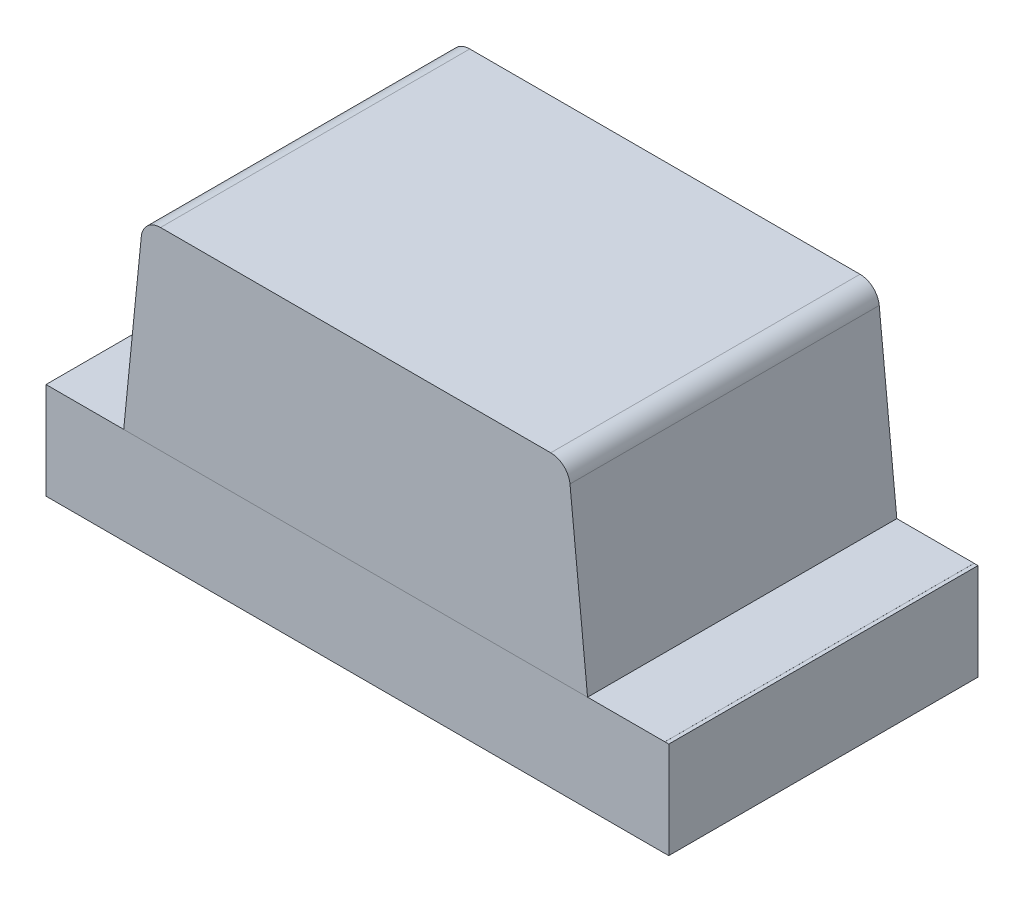
from build123d import *

# Parameters (mm, degrees)
SKETCH1_W             = 1.6
SKETCH1_H             = 0.25
EXTRUDE1_DEPTH        = 0.4
EXTRUDE2_DEPTH        = 0.4
EXTRUDE3_DEPTH        = 0.0001
EXTRUDE3_DEPTH_BACK   = 0.01
EXTRUDE4_DEPTH        = 0.0001
EXTRUDE4_DEPTH_BACK   = 0.01
SKETCH2_3_W           = 0.3
SKETCH2_3_H           = 0.8
EXTRUDE4_2_DEPTH      = 0.0001
EXTRUDE4_2_DEPTH_BACK = 0.01
EXTRUDE5_DEPTH        = 0.0001
EXTRUDE5_DEPTH_BACK   = 0.01
SKETCH3_W             = 0.2
SKETCH3_H             = 0.8
EXTRUDE5_2_DEPTH      = 0.0001
EXTRUDE5_2_DEPTH_BACK = 0.01
FILLET1_R             = 0.05
EXTRUDE6_DEPTH        = 0.01
EXTRUDE6_DEPTH_BACK   = 0.0001
SKETCH5_W             = 0.8
SKETCH5_H             = 0.25
EXTRUDE7_DEPTH        = 0.001
EXTRUDE7_DEPTH_BACK   = 0.01
SKETCH6_W             = 0.8
SKETCH6_H             = 0.2502
SKETCH7_W             = 0.013291139
SKETCH7_H             = 0.012658227
SKETCH7_H_2           = 0.012658228
CUT_EXTRUDE1_DEPTH    = 0.01


with BuildPart() as part:
    # Sketch1 → Extrude1 (new, symmetric)
    with BuildSketch(Plane.XY):
        Rectangle(SKETCH1_W, SKETCH1_H)
    extrude(amount=EXTRUDE1_DEPTH, both=True)



with BuildPart() as body_2:
    # Sketch1<3> → Extrude2 (new, symmetric)
    with BuildSketch(Plane.XY):
        Polygon((-0.55, 0.625), (-0.6, 0.125), (0.6, 0.125), (0.55, 0.625), align=None)
    extrude(amount=EXTRUDE2_DEPTH, both=True)

    # Fillet1
    fillet1_edges = [body_2.edges().sort_by_distance(p)[0] for p in [
        (-0.55, 0.625, 0),
        (0.55, 0.625, 0),
    ]]
    fillet(fillet1_edges, radius=FILLET1_R)


with BuildPart() as body_3:
    # Sketch2 → Extrude3 (new, two sides: drawn at the far end of the back side and taken through both)
    with BuildSketch(Plane.XZ.offset(0.125).offset(-EXTRUDE3_DEPTH_BACK)):
        Polygon((-0.339833711, 0.4), (-0.339833711, -0.4), (0.32532124, 0), align=None)
    extrude(amount=EXTRUDE3_DEPTH + EXTRUDE3_DEPTH_BACK)


with BuildPart() as body_4:
    # Sketch2<3> → Extrude4 (new, two sides: drawn at the far end of the back side and taken through both)
    with BuildSketch(Plane.XZ.offset(0.125).offset(-EXTRUDE4_DEPTH_BACK)):
        with Locations((-0.65, 0)):
            Rectangle(SKETCH2_3_W, SKETCH2_3_H)
    extrude(amount=EXTRUDE4_DEPTH + EXTRUDE4_DEPTH_BACK)


with BuildPart() as body_5:
    # Sketch2<3> → Extrude4 2 (new, two sides: drawn at the far end of the back side and taken through both)
    with BuildSketch(Plane.XZ.offset(0.125).offset(-EXTRUDE4_2_DEPTH_BACK)):
        with Locations((0.65, 0)):
            Rectangle(SKETCH2_3_W, SKETCH2_3_H)
    extrude(amount=EXTRUDE4_2_DEPTH + EXTRUDE4_2_DEPTH_BACK)


with BuildPart() as body_6:
    # Sketch3 → Extrude5 (new, two sides: drawn at the far end of the back side and taken through both)
    with BuildSketch(Plane(origin=(0, 0.125, 0), x_dir=(-1, 0, 0), z_dir=(0, 1, 0)).offset(-EXTRUDE5_DEPTH_BACK)):
        with Locations((0.7, 0)):
            Rectangle(SKETCH3_W, SKETCH3_H)
    extrude(amount=EXTRUDE5_DEPTH + EXTRUDE5_DEPTH_BACK)


with BuildPart() as body_7:
    # Sketch3 → Extrude5 2 (new, two sides: drawn at the far end of the back side and taken through both)
    with BuildSketch(Plane(origin=(0, 0.125, 0), x_dir=(-1, 0, 0), z_dir=(0, 1, 0)).offset(-EXTRUDE5_2_DEPTH_BACK)):
        with Locations((-0.7, 0)):
            Rectangle(SKETCH3_W, SKETCH3_H)
    extrude(amount=EXTRUDE5_2_DEPTH + EXTRUDE5_2_DEPTH_BACK)


with BuildPart() as part_1:
    add(part.part)

    add(body_5.part)  # Extrude6 merges body 5

    add(body_7.part)  # Extrude6 merges body 7
    # Sketch5 → Extrude6 (add, two sides: drawn at the far end of the back side and taken through both)
    with BuildSketch(Plane(origin=(0.8, 0, 0), x_dir=(0, 0, -1), z_dir=(1, 0, 0)).offset(-EXTRUDE6_DEPTH_BACK)):
        Rectangle(SKETCH5_W, SKETCH5_H)
    extrude(amount=EXTRUDE6_DEPTH + EXTRUDE6_DEPTH_BACK)


    add(body_4.part)  # Extrude7 merges body 4

    add(body_6.part)  # Extrude7 merges body 6
    # Sketch6 → Extrude7 (add, two sides: drawn at the far end of the back side and taken through both)
    with BuildSketch(Plane.ZY.offset(0.8).offset(-EXTRUDE7_DEPTH_BACK)):
        Rectangle(SKETCH6_W, SKETCH6_H)
    extrude(amount=EXTRUDE7_DEPTH + EXTRUDE7_DEPTH_BACK)

    # Sketch7 → Cut-Extrude1 (cut)
    # profile 1 of 14: a face of its own
    with BuildSketch(Plane.XZ.offset(0.1251)):
        Polygon((-0.707001992, 0.286075949), (-0.744343764, 0.297804589), (-0.744343764, 0.310176028), (-0.719175647, 0.318384098), (-0.744343764, 0.326147152), (-0.744343764, 0.339013054), (-0.707001992, 0.350632911), (-0.707001992, 0.338043908), (-0.732743685, 0.331546677), (-0.707001992, 0.323338608), (-0.707001992, 0.312589003), (-0.732743685, 0.30443038), (-0.707001992, 0.298022152), align=None)
    # profile 2 of 14: a face of its own
    with BuildSketch(Plane.XZ.offset(0.1251)):
        Polygon((-0.707001992, 0.218987342), (-0.744343764, 0.230715981), (-0.744343764, 0.243087421), (-0.719175647, 0.251295491), (-0.744343764, 0.259058544), (-0.744343764, 0.271924446), (-0.707001992, 0.283544304), (-0.707001992, 0.270955301), (-0.732743685, 0.26445807), (-0.707001992, 0.25625), (-0.707001992, 0.245500396), (-0.732743685, 0.237341772), (-0.707001992, 0.230933544), align=None)
    # profile 3 of 14: a face of its own
    with BuildSketch(Plane.XZ.offset(0.1251)):
        Polygon((-0.707001992, 0.151898734), (-0.744343764, 0.163627373), (-0.744343764, 0.175998813), (-0.719175647, 0.184206883), (-0.744343764, 0.191969937), (-0.744343764, 0.204835839), (-0.707001992, 0.216455696), (-0.707001992, 0.203866693), (-0.732743685, 0.197369462), (-0.707001992, 0.189161392), (-0.707001992, 0.178411788), (-0.732743685, 0.170253165), (-0.707001992, 0.163844937), align=None)
    # profile 4 of 14: a face of its own
    with BuildSketch(Plane.XZ.offset(0.1251)):
        with Locations((-0.737698195, 0.137974684)):
            Rectangle(SKETCH7_W, SKETCH7_H)
    # profile 5 of 14: a face of its own
    with BuildSketch(Plane.XZ.offset(0.1251)):
        with BuildLine():
            add(Edge.make_bspline(
                [(-0.728758321, 0.079746835), (-0.729369388, 0.079765085), (-0.73056932, 0.07980092), (-0.732323163, 0.080105713), (-0.733985315, 0.080602697), (-0.735567388, 0.081288866), (-0.737052132, 0.082185594), (-0.738453578, 0.08327723), (-0.73975585, 0.084571671), (-0.740974038, 0.086045073), (-0.742065093, 0.087693545), (-0.74301811, 0.089492402), (-0.743815446, 0.091432415), (-0.744484978, 0.093506521), (-0.744979195, 0.095729794), (-0.745341189, 0.098088543), (-0.745577848, 0.100585257), (-0.745598831, 0.102297046), (-0.745609587, 0.103174446)],
                knots=[0, 0, 0, 0, 0.907312236, 1.78165839, 2.635367075, 3.479697475, 4.336364812, 5.205276731, 6.11257575, 7.058770404, 8.040786331, 9.044147278, 10.078219212, 11.153049307, 12.278104542, 13.457648573, 14.696882856, 16, 16, 16, 16], degree=3))
            add(Edge.make_bspline(
                [(-0.745609587, 0.103174446), (-0.745597551, 0.104183574), (-0.745574239, 0.106138165), (-0.745359939, 0.108969928), (-0.74503687, 0.111603946), (-0.744553599, 0.114051804), (-0.743953216, 0.116354103), (-0.74330757, 0.118570737), (-0.742575363, 0.120711393), (-0.742025284, 0.122097938), (-0.741752783, 0.12278481)],
                knots=[0, 0, 0, 0, 1.203215828, 2.33052265, 3.384689099, 4.366106119, 5.303329643, 6.221311756, 7.118865988, 8, 8, 8, 8], degree=3))
            Line((-0.741752783, 0.12278481), (-0.729786802, 0.12278481))
            Line((-0.729786802, 0.12278481), (-0.729786802, 0.121360759))
            add(Edge.make_bspline(
                [(-0.729786802, 0.121360759), (-0.73032753, 0.120678102), (-0.73140581, 0.119316796), (-0.732787113, 0.11710018), (-0.733988194, 0.114776357), (-0.734975195, 0.112353621), (-0.735768357, 0.109905199), (-0.736315121, 0.10746751), (-0.736688795, 0.105084716), (-0.736729049, 0.103505432), (-0.736748828, 0.10272943)],
                knots=[0, 0, 0, 0, 1.030622468, 2.055194264, 3.087043286, 4.125157485, 5.149848264, 6.130935704, 7.081611712, 8, 8, 8, 8], degree=3))
            add(Edge.make_bspline(
                [(-0.736748828, 0.10272943), (-0.73674838, 0.102515041), (-0.736747423, 0.10205605), (-0.736683001, 0.101322032), (-0.73663642, 0.100492732), (-0.736531811, 0.099603299), (-0.736422519, 0.09870789), (-0.736232359, 0.09788056), (-0.73605144, 0.097128741), (-0.735867351, 0.0966755), (-0.735779682, 0.096459652)],
                knots=[0, 0, 0, 0, 0.806378557, 1.726393851, 2.771014456, 3.931269413, 5.096090628, 6.161710732, 7.124547685, 8, 8, 8, 8], degree=3))
            add(Edge.make_bspline(
                [(-0.735779682, 0.096459652), (-0.73566577, 0.096219758), (-0.735441909, 0.095748317), (-0.735033106, 0.095100857), (-0.734597455, 0.094509521), (-0.734114745, 0.093978791), (-0.733525791, 0.093553657), (-0.732825363, 0.093239557), (-0.732000213, 0.09306801), (-0.731412708, 0.093048363), (-0.731102071, 0.093037975)],
                knots=[0, 0, 0, 0, 1.024407818, 2.013179384, 2.949802342, 3.859052226, 4.77034807, 5.732977883, 6.801339628, 8, 8, 8, 8], degree=3))
            add(Edge.make_bspline(
                [(-0.731102071, 0.093037975), (-0.730829123, 0.093053696), (-0.730292427, 0.093084607), (-0.729528429, 0.093375503), (-0.72881749, 0.093816952), (-0.728187133, 0.094460463), (-0.727608414, 0.095257502), (-0.727123265, 0.09623537), (-0.726683228, 0.09736186), (-0.726474594, 0.098184089), (-0.726365125, 0.098615506)],
                knots=[0, 0, 0, 0, 0.825212765, 1.622611382, 2.449701629, 3.348069183, 4.336544339, 5.428209675, 6.6506027, 8, 8, 8, 8], degree=3))
            add(Edge.make_bspline(
                [(-0.726365125, 0.098615506), (-0.726141255, 0.09959987), (-0.72568266, 0.101616324), (-0.725109106, 0.104690378), (-0.72447607, 0.107755492), (-0.723871299, 0.109734848), (-0.723576359, 0.110700158)],
                knots=[0, 0, 0, 0, 0.976104583, 1.999535498, 3.024395274, 4, 4, 4, 4], degree=3))
            add(Edge.make_bspline(
                [(-0.723576359, 0.110700158), (-0.723399863, 0.111219416), (-0.723056296, 0.1122302), (-0.722475484, 0.113675972), (-0.721840508, 0.115006529), (-0.721162942, 0.116226584), (-0.720425943, 0.117326245), (-0.719659249, 0.11832384), (-0.71883233, 0.119195603), (-0.71796637, 0.119969445), (-0.717040369, 0.120631102), (-0.7160683, 0.121208477), (-0.715038068, 0.121696295), (-0.713957424, 0.122100736), (-0.712817989, 0.122409273), (-0.711629552, 0.122619901), (-0.710387872, 0.122769095), (-0.709540696, 0.122779501), (-0.7091084, 0.12278481)],
                knots=[0, 0, 0, 0, 1.287286806, 2.505824366, 3.654938963, 4.74627059, 5.778586806, 6.75996495, 7.696030012, 8.595059759, 9.482019644, 10.363222407, 11.245851011, 12.154256429, 13.068444161, 14.012503255, 14.985824751, 16, 16, 16, 16], degree=3))
            add(Edge.make_bspline(
                [(-0.7091084, 0.12278481), (-0.708530328, 0.122766159), (-0.707392692, 0.122729454), (-0.70572817, 0.12242874), (-0.704153801, 0.121915445), (-0.70265207, 0.121222413), (-0.701245527, 0.120308099), (-0.699906253, 0.119215702), (-0.698670457, 0.117903678), (-0.697520291, 0.116415118), (-0.696480591, 0.114771425), (-0.695565313, 0.113001934), (-0.694796987, 0.111117289), (-0.69416004, 0.109124516), (-0.693682705, 0.107015281), (-0.693323239, 0.104796665), (-0.693116648, 0.102459771), (-0.693091023, 0.10086406), (-0.693077942, 0.100049446)],
                knots=[0, 0, 0, 0, 0.894990994, 1.761326291, 2.609044902, 3.454222546, 4.315366365, 5.200560057, 6.125081389, 7.100429509, 8.110379559, 9.133447974, 10.182136699, 11.259192205, 12.370181258, 13.528580438, 14.738335141, 16, 16, 16, 16], degree=3))
            add(Edge.make_bspline(
                [(-0.693077942, 0.100049446), (-0.693089037, 0.099215103), (-0.69311121, 0.09754783), (-0.693300199, 0.095057109), (-0.693577813, 0.092576858), (-0.693998666, 0.090144943), (-0.694486874, 0.087799665), (-0.695034772, 0.085593047), (-0.695653754, 0.083553317), (-0.696130927, 0.082266485), (-0.696361169, 0.08164557)],
                knots=[0, 0, 0, 0, 1.065403572, 2.129000689, 3.188532477, 4.251604565, 5.279552602, 6.247508681, 7.154397237, 8, 8, 8, 8], degree=3))
            Line((-0.696361169, 0.08164557), (-0.707634904, 0.08164557))
            Line((-0.707634904, 0.08164557), (-0.707634904, 0.083059731))
            add(Edge.make_bspline(
                [(-0.707634904, 0.083059731), (-0.70723473, 0.083596183), (-0.706416365, 0.084693243), (-0.705374529, 0.086523061), (-0.704395596, 0.088502179), (-0.703553517, 0.090641594), (-0.702823776, 0.092871108), (-0.702314193, 0.095162587), (-0.701993288, 0.097475669), (-0.701956901, 0.099026524), (-0.701938701, 0.099802215)],
                knots=[0, 0, 0, 0, 0.892283326, 1.824742884, 2.804416662, 3.836872171, 4.8899239, 5.931447339, 6.965372909, 8, 8, 8, 8], degree=3))
            add(Edge.make_bspline(
                [(-0.701938701, 0.099802215), (-0.701949427, 0.100350049), (-0.701970878, 0.101445657), (-0.70216622, 0.103079762), (-0.702481667, 0.104700792), (-0.702891308, 0.105721053), (-0.703095742, 0.106230222)],
                knots=[0, 0, 0, 0, 0.999146175, 1.998183711, 3.000980573, 4, 4, 4, 4], degree=3))
            add(Edge.make_bspline(
                [(-0.703095742, 0.106230222), (-0.703196476, 0.106446973), (-0.703397875, 0.106880332), (-0.703784157, 0.107483654), (-0.704248563, 0.108035989), (-0.704774559, 0.108532027), (-0.705352745, 0.108966226), (-0.705990159, 0.109273902), (-0.706671616, 0.109461838), (-0.707139231, 0.109482917), (-0.707377783, 0.109493671)],
                knots=[0, 0, 0, 0, 1.00524851, 2.009826503, 3.004679593, 4.035271301, 5.048246368, 6.034938417, 6.997532266, 8, 8, 8, 8], degree=3))
            add(Edge.make_bspline(
                [(-0.707377783, 0.109493671), (-0.707696866, 0.109476452), (-0.708306604, 0.109443548), (-0.709164502, 0.109140256), (-0.709903719, 0.108647839), (-0.710401179, 0.108067536), (-0.710749898, 0.107508972), (-0.711005153, 0.106991142), (-0.711246832, 0.106386528), (-0.711495567, 0.105700905), (-0.71174116, 0.104932741), (-0.711978934, 0.104078462), (-0.712203582, 0.103137104), (-0.712346677, 0.102479167), (-0.712421296, 0.102136076)],
                knots=[0, 0, 0, 0, 1.173816843, 2.243057204, 3.312297565, 4.415174738, 5.03266065, 5.73970059, 6.541434878, 7.433956553, 8.430083051, 9.515931566, 10.70464786, 12, 12, 12, 12], degree=3))
            add(Edge.make_bspline(
                [(-0.712421296, 0.102136076), (-0.712609327, 0.101219681), (-0.712978766, 0.099419168), (-0.71353051, 0.096718577), (-0.714167994, 0.09396719), (-0.714742396, 0.092134526), (-0.715041945, 0.091178797)],
                knots=[0, 0, 0, 0, 0.995744513, 1.956417928, 2.934277412, 4, 4, 4, 4], degree=3))
            add(Edge.make_bspline(
                [(-0.715041945, 0.091178797), (-0.715201567, 0.09070552), (-0.715513813, 0.089779714), (-0.716056954, 0.088459399), (-0.716643946, 0.087235869), (-0.717264711, 0.086102353), (-0.717936694, 0.085065368), (-0.718648018, 0.084118027), (-0.719411472, 0.083276117), (-0.720218086, 0.082527335), (-0.721073136, 0.081867755), (-0.721992673, 0.081301606), (-0.722967074, 0.080815492), (-0.724010174, 0.080430689), (-0.725107467, 0.080121679), (-0.726273151, 0.079910131), (-0.72749534, 0.079763139), (-0.728332628, 0.079752331), (-0.728758321, 0.079746835)],
                knots=[0, 0, 0, 0, 1.237467875, 2.420686895, 3.535046182, 4.599015201, 5.620884487, 6.594603852, 7.531477383, 8.433220087, 9.318759595, 10.202828513, 11.105163009, 12.01247538, 12.953896178, 13.926381251, 14.945733412, 16, 16, 16, 16], degree=3))
        make_face()
    # profile 6 of 14: a face of its own
    with BuildSketch(Plane.XZ.offset(0.1251)):
        with BuildLine():
            Line((-0.744343764, 0.033544304), (-0.744343764, 0.04556962))
            Line((-0.744343764, 0.04556962), (-0.740427625, 0.04556962))
            add(Edge.make_bspline(
                [(-0.740427625, 0.04556962), (-0.740831904, 0.046116275), (-0.741611349, 0.047170216), (-0.742651457, 0.048756729), (-0.74353909, 0.050269774), (-0.744318701, 0.051726519), (-0.744906393, 0.053237621), (-0.745320427, 0.054853378), (-0.745570313, 0.05660479), (-0.745596205, 0.057818238), (-0.745609587, 0.058445411)],
                knots=[0, 0, 0, 0, 1.150872466, 2.218865267, 3.209461834, 4.120482262, 5.012764827, 5.946708227, 6.938749913, 8, 8, 8, 8], degree=3))
            add(Edge.make_bspline(
                [(-0.745609587, 0.058445411), (-0.745598228, 0.058953587), (-0.745576107, 0.059943153), (-0.745403669, 0.061381773), (-0.745134843, 0.062735587), (-0.744731047, 0.063993106), (-0.744248146, 0.065175101), (-0.743608167, 0.066243876), (-0.74289308, 0.067245677), (-0.742039557, 0.068136513), (-0.74109069, 0.068944324), (-0.74002446, 0.069635599), (-0.738857998, 0.070224454), (-0.737582071, 0.070695003), (-0.736202919, 0.071072548), (-0.734713295, 0.071334514), (-0.733119731, 0.07149481), (-0.732022166, 0.07151078), (-0.731458084, 0.071518987)],
                knots=[0, 0, 0, 0, 1.109008058, 2.159558935, 3.158726032, 4.116861086, 5.039058877, 5.938775559, 6.82970133, 7.720510853, 8.624361809, 9.544451588, 10.487360536, 11.471068125, 12.508000841, 13.604731202, 14.768976642, 16, 16, 16, 16], degree=3))
            Line((-0.731458084, 0.071518987), (-0.707001992, 0.071518987))
            Line((-0.707001992, 0.071518987), (-0.707001992, 0.059493671))
            Line((-0.707001992, 0.059493671), (-0.725791549, 0.059493671))
            add(Edge.make_bspline(
                [(-0.725791549, 0.059493671), (-0.726249785, 0.059492853), (-0.727126892, 0.059491288), (-0.728379796, 0.059450118), (-0.729513882, 0.059389668), (-0.730534896, 0.059320316), (-0.731458272, 0.059193807), (-0.732291352, 0.059004953), (-0.733051153, 0.05876954), (-0.733504504, 0.058537381), (-0.73372272, 0.058425633)],
                knots=[0, 0, 0, 0, 1.361401701, 2.605856924, 3.723918663, 4.735739235, 5.645738665, 6.489217889, 7.27279937, 8, 8, 8, 8], degree=3))
            add(Edge.make_bspline(
                [(-0.73372272, 0.058425633), (-0.733922077, 0.05831063), (-0.734313997, 0.058084543), (-0.734817086, 0.057624398), (-0.73523922, 0.057085026), (-0.735567234, 0.056446225), (-0.735816709, 0.055702951), (-0.735986827, 0.054838985), (-0.736094578, 0.053846304), (-0.736108532, 0.053141795), (-0.736115916, 0.052768987)],
                knots=[0, 0, 0, 0, 0.849138082, 1.669332372, 2.503455908, 3.370611167, 4.311442699, 5.394692208, 6.621337967, 8, 8, 8, 8], degree=3))
            add(Edge.make_bspline(
                [(-0.736115916, 0.052768987), (-0.736107238, 0.052498345), (-0.736089394, 0.051941887), (-0.735973171, 0.05108623), (-0.735794834, 0.050187942), (-0.735464906, 0.04893065), (-0.734871816, 0.047347337), (-0.734194613, 0.046167686), (-0.73385128, 0.04556962)],
                knots=[0, 0, 0, 0, 0.638127216, 1.312033637, 2.033062677, 2.79661882, 4.375931797, 6, 6, 6, 6], degree=3))
            Line((-0.73385128, 0.04556962), (-0.707001992, 0.04556962))
            Line((-0.707001992, 0.04556962), (-0.707001992, 0.033544304))
            Line((-0.707001992, 0.033544304), (-0.744343764, 0.033544304))
        make_face()
    # profile 7 of 14: a face of its own
    with BuildSketch(Plane.XZ.offset(0.1251)):
        with BuildLine():
            Line((-0.744343764, -0.015189873), (-0.744343764, -0.003164557))
            Line((-0.744343764, -0.003164557), (-0.725554207, -0.003164557))
            add(Edge.make_bspline(
                [(-0.725554207, -0.003164557), (-0.724789186, -0.0031523), (-0.723263673, -0.003127858), (-0.721382468, -0.002986796), (-0.719961306, -0.002797535), (-0.719042365, -0.002612707), (-0.718268296, -0.002396857), (-0.717825416, -0.002190717), (-0.717623036, -0.002096519)],
                knots=[0, 0, 0, 0, 1.709124929, 3.408128882, 4.211124727, 4.91016634, 5.501986363, 6, 6, 6, 6], degree=3))
            add(Edge.make_bspline(
                [(-0.717623036, -0.002096519), (-0.71742401, -0.001974288), (-0.71703379, -0.001734636), (-0.716527283, -0.001265974), (-0.716112863, -0.000719031), (-0.715772088, -8.3646e-05), (-0.715536797, 0.000661952), (-0.715340182, 0.001520323), (-0.715256728, 0.002513632), (-0.715239148, 0.003217267), (-0.71522984, 0.003589794)],
                knots=[0, 0, 0, 0, 0.86006424, 1.686277094, 2.52783008, 3.38194165, 4.331801563, 5.402842185, 6.624978739, 8, 8, 8, 8], degree=3))
            add(Edge.make_bspline(
                [(-0.71522984, 0.003589794), (-0.715258209, 0.004155705), (-0.715316136, 0.005311252), (-0.715671889, 0.006742349), (-0.716081369, 0.007907651), (-0.716460784, 0.008833913), (-0.716946505, 0.009788229), (-0.717307416, 0.010427935), (-0.717494476, 0.010759494)],
                knots=[0, 0, 0, 0, 1.338371478, 2.732853438, 3.468019217, 4.261884641, 5.099136535, 6, 6, 6, 6], degree=3))
            Line((-0.717494476, 0.010759494), (-0.744343764, 0.010759494))
            Line((-0.744343764, 0.010759494), (-0.744343764, 0.02278481))
            Line((-0.744343764, 0.02278481), (-0.707001992, 0.02278481))
            Line((-0.707001992, 0.02278481), (-0.707001992, 0.010759494))
            Line((-0.707001992, 0.010759494), (-0.710918131, 0.010759494))
            add(Edge.make_bspline(
                [(-0.710918131, 0.010759494), (-0.710515056, 0.01023079), (-0.709730445, 0.009201638), (-0.708710234, 0.007612019), (-0.70781085, 0.00607007), (-0.707054441, 0.004543565), (-0.706451054, 0.002986088), (-0.706045559, 0.001354709), (-0.705773658, -0.000353494), (-0.705748811, -0.001521852), (-0.705736169, -0.002116297)],
                knots=[0, 0, 0, 0, 1.126119141, 2.192057864, 3.198061997, 4.149848529, 5.076251285, 6.021887753, 6.99356175, 8, 8, 8, 8], degree=3))
            add(Edge.make_bspline(
                [(-0.705736169, -0.002116297), (-0.705748864, -0.002614433), (-0.705773646, -0.003586883), (-0.705928501, -0.005004263), (-0.706203833, -0.006339973), (-0.706602748, -0.00758611), (-0.707095554, -0.00875742), (-0.707711311, -0.009838393), (-0.708440523, -0.010834428), (-0.709271024, -0.011748628), (-0.710215887, -0.012564037), (-0.711274519, -0.013272555), (-0.712446068, -0.013862546), (-0.713726222, -0.014347902), (-0.715108777, -0.014735114), (-0.716606759, -0.014992679), (-0.718208849, -0.015169571), (-0.71931687, -0.015182971), (-0.719887673, -0.015189873)],
                knots=[0, 0, 0, 0, 1.08848837, 2.124922927, 3.110950502, 4.063144162, 4.979605775, 5.882838355, 6.774625441, 7.671951181, 8.57587277, 9.494821853, 10.448322275, 11.435533005, 12.482327682, 13.580118324, 14.753386918, 16, 16, 16, 16], degree=3))
            Line((-0.719887673, -0.015189873), (-0.744343764, -0.015189873))
        make_face()
    # profile 8 of 14: a face of its own
    with BuildSketch(Plane.XZ.offset(0.1251)):
        Polygon((-0.744343764, -0.062658228), (-0.744343764, -0.026582278), (-0.694343764, -0.026582278), (-0.694343764, -0.039240506), (-0.734850093, -0.039240506), (-0.734850093, -0.062658228), align=None)
    # profile 9 of 14: a face of its own
    with BuildSketch(Plane.XZ.offset(0.1251)):
        Polygon((-0.744343764, -0.106329114), (-0.744343764, -0.070253165), (-0.694343764, -0.070253165), (-0.694343764, -0.106329114), (-0.703837435, -0.106329114), (-0.703837435, -0.082911392), (-0.712698195, -0.082911392), (-0.712698195, -0.10443038), (-0.722191866, -0.10443038), (-0.722191866, -0.082911392), (-0.734850093, -0.082911392), (-0.734850093, -0.106329114), align=None)
    # profile 10 of 14: a face of its own
    with BuildSketch(Plane.XZ.offset(0.1251)):
        with BuildLine():
            add(Edge.make_bspline(
                [(-0.719393211, -0.164556962), (-0.719967055, -0.164547304), (-0.721103498, -0.164528178), (-0.722785901, -0.164380583), (-0.724418739, -0.16411757), (-0.726010863, -0.163777979), (-0.727550327, -0.163316726), (-0.729054116, -0.16277587), (-0.730506863, -0.162121047), (-0.73190758, -0.16136862), (-0.733243631, -0.160543884), (-0.734503736, -0.15965651), (-0.735695344, -0.15873362), (-0.736792791, -0.157738964), (-0.737813801, -0.156699373), (-0.738759208, -0.155611609), (-0.739610924, -0.154459076), (-0.740122366, -0.153655495), (-0.740378179, -0.15325356)],
                knots=[0, 0, 0, 0, 1.105570398, 2.18947457, 3.250358341, 4.290584537, 5.323553275, 6.344225964, 7.367641686, 8.3905646, 9.405808457, 10.390761353, 11.358902336, 12.307789878, 13.241960776, 14.165076779, 15.082208636, 16, 16, 16, 16], degree=3))
            add(Edge.make_bspline(
                [(-0.740378179, -0.15325356), (-0.740734249, -0.152633946), (-0.741448205, -0.151391556), (-0.7422825, -0.149399639), (-0.742984558, -0.147336898), (-0.74351177, -0.145161705), (-0.743875292, -0.1428382), (-0.744155696, -0.140337495), (-0.744306575, -0.1376337), (-0.744331085, -0.135766253), (-0.744343764, -0.134800237)],
                knots=[0, 0, 0, 0, 0.896288622, 1.797150563, 2.705281913, 3.629615989, 4.602417572, 5.655716007, 6.787320449, 8, 8, 8, 8], degree=3))
            Line((-0.744343764, -0.134800237), (-0.744343764, -0.117088608))
            Line((-0.744343764, -0.117088608), (-0.694343764, -0.117088608))
            Line((-0.694343764, -0.117088608), (-0.694343764, -0.135304589))
            add(Edge.make_bspline(
                [(-0.694343764, -0.135304589), (-0.69435207, -0.136293955), (-0.69436809, -0.138202319), (-0.694576885, -0.140960738), (-0.694875297, -0.143513342), (-0.695337733, -0.145856016), (-0.695895405, -0.148006019), (-0.69657497, -0.149968756), (-0.697324323, -0.151774643), (-0.69796117, -0.152864064), (-0.698269793, -0.153392009)],
                knots=[0, 0, 0, 0, 1.267175336, 2.444223962, 3.542125549, 4.557526608, 5.500936977, 6.385043188, 7.217374394, 8, 8, 8, 8], degree=3))
            add(Edge.make_bspline(
                [(-0.698269793, -0.153392009), (-0.698538063, -0.153817486), (-0.69907152, -0.154663548), (-0.699962446, -0.155864156), (-0.700940485, -0.156978869), (-0.701966394, -0.158043121), (-0.703067837, -0.15903303), (-0.704237191, -0.159954629), (-0.705476238, -0.160806538), (-0.706780972, -0.16158552), (-0.708145998, -0.162295927), (-0.709582528, -0.16289058), (-0.711071793, -0.163415255), (-0.712626274, -0.163818023), (-0.714230192, -0.16416698), (-0.715900864, -0.164384347), (-0.717627108, -0.164527653), (-0.718799553, -0.16454711), (-0.719393211, -0.164556962)],
                knots=[0, 0, 0, 0, 0.964065863, 1.917049184, 2.86229036, 3.805247319, 4.749389377, 5.698846072, 6.657678277, 7.629829384, 8.610569287, 9.604676042, 10.607940105, 11.6349849, 12.681042988, 13.752616828, 14.862056989, 16, 16, 16, 16], degree=3))
        make_face()
        with BuildLine():
            add(Edge.make_bspline(
                [(-0.719314097, -0.151265823), (-0.718911717, -0.151260702), (-0.718122425, -0.151250659), (-0.716964667, -0.151154875), (-0.715849842, -0.151025347), (-0.714782496, -0.15080982), (-0.713752711, -0.150559996), (-0.712773964, -0.150238922), (-0.711834177, -0.149876723), (-0.710945433, -0.149435904), (-0.710091242, -0.148949086), (-0.709298484, -0.148375339), (-0.708542041, -0.14775117), (-0.707828049, -0.147062027), (-0.707175101, -0.146290557), (-0.706560063, -0.145460506), (-0.7059959, -0.144560327), (-0.705665875, -0.143923833), (-0.705498828, -0.143601661)],
                knots=[0, 0, 0, 0, 1.152093354, 2.259898929, 3.325467225, 4.364140538, 5.376172865, 6.358396836, 7.312077728, 8.257828931, 9.196960457, 10.124297759, 11.056236784, 12.004246951, 12.961658638, 13.947279359, 14.960983522, 16, 16, 16, 16], degree=3))
            add(Edge.make_bspline(
                [(-0.705498828, -0.143601661), (-0.705345472, -0.143264213), (-0.705041509, -0.142595365), (-0.704675913, -0.141559954), (-0.704389495, -0.140515262), (-0.704174066, -0.139414463), (-0.704013101, -0.138179583), (-0.703914472, -0.136716792), (-0.703843387, -0.134988837), (-0.703839511, -0.13374548), (-0.703837435, -0.133079509)],
                knots=[0, 0, 0, 0, 0.826967603, 1.639107464, 2.447640171, 3.242670507, 4.14065217, 5.225198036, 6.513753944, 8, 8, 8, 8], degree=3))
            Line((-0.703837435, -0.133079509), (-0.703837435, -0.129746835))
            Line((-0.703837435, -0.129746835), (-0.734850093, -0.129746835))
            Line((-0.734850093, -0.129746835), (-0.734850093, -0.133079509))
            add(Edge.make_bspline(
                [(-0.734850093, -0.133079509), (-0.734847719, -0.133458613), (-0.734843134, -0.134190496), (-0.734821603, -0.135248617), (-0.734798159, -0.136231516), (-0.734739928, -0.137133951), (-0.734703605, -0.137963293), (-0.734614415, -0.138706684), (-0.734543325, -0.139377929), (-0.734409464, -0.140161727), (-0.734201372, -0.14108831), (-0.733862283, -0.14216894), (-0.733437085, -0.143239207), (-0.733094602, -0.143933494), (-0.732921692, -0.144284019)],
                knots=[0, 0, 0, 0, 1.186793418, 2.291178421, 3.313283093, 4.264083014, 5.122158624, 5.910777728, 6.607099052, 7.234812932, 8.398911528, 9.577194775, 10.776795607, 12, 12, 12, 12], degree=3))
            add(Edge.make_bspline(
                [(-0.732921692, -0.144284019), (-0.732750933, -0.144576577), (-0.732414176, -0.14515354), (-0.731847139, -0.145965292), (-0.731243277, -0.146719151), (-0.730599051, -0.147417157), (-0.729904931, -0.148048807), (-0.72917166, -0.148624816), (-0.728397671, -0.149140041), (-0.727300912, -0.149757735), (-0.725785444, -0.150369358), (-0.72380175, -0.15088913), (-0.721621869, -0.151207565), (-0.72010306, -0.151245906), (-0.719314097, -0.151265823)],
                knots=[0, 0, 0, 0, 0.755160452, 1.489275589, 2.205657296, 2.907868421, 3.605098304, 4.296256403, 4.985378686, 5.676536785, 7.100390329, 8.614249252, 10.241231541, 12, 12, 12, 12], degree=3))
        make_face(mode=Mode.SUBTRACT)
    # profile 11 of 14: a face of its own
    with BuildSketch(Plane.XZ.offset(0.1251)):
        with Locations((-0.737698195, -0.180379747)):
            Rectangle(SKETCH7_W, SKETCH7_H_2)
    # profile 12 of 14: a face of its own
    with BuildSketch(Plane.XZ.offset(0.1251)):
        with BuildLine():
            add(Edge.make_bspline(
                [(-0.745609587, -0.217701741), (-0.745598682, -0.216906684), (-0.745577276, -0.215346116), (-0.745338817, -0.213060445), (-0.74497997, -0.210877859), (-0.744469516, -0.208804705), (-0.743795768, -0.206847809), (-0.7429693, -0.20501599), (-0.741976708, -0.203312562), (-0.741187104, -0.202283238), (-0.740793527, -0.201770174)],
                knots=[0, 0, 0, 0, 1.123670284, 2.205584497, 3.245308791, 4.249063313, 5.220352711, 6.167273909, 7.086481357, 8, 8, 8, 8], degree=3))
            add(Edge.make_bspline(
                [(-0.740793527, -0.201770174), (-0.74036614, -0.2012943), (-0.739513018, -0.200344393), (-0.738027305, -0.199111426), (-0.736385783, -0.198049884), (-0.734584672, -0.197157107), (-0.732626307, -0.196441646), (-0.730503976, -0.195930079), (-0.728223586, -0.195620456), (-0.726649619, -0.195586873), (-0.725840995, -0.19556962)],
                knots=[0, 0, 0, 0, 0.916457077, 1.82937027, 2.759194969, 3.714948755, 4.706655623, 5.743329475, 6.840637961, 8, 8, 8, 8], degree=3))
            add(Edge.make_bspline(
                [(-0.725840995, -0.19556962), (-0.724989382, -0.195589), (-0.723338842, -0.195626562), (-0.720952748, -0.195958442), (-0.718743908, -0.196493248), (-0.716717954, -0.197262027), (-0.714871358, -0.198227248), (-0.71318544, -0.199359494), (-0.711663978, -0.200669757), (-0.710791259, -0.201673326), (-0.710354445, -0.202175633)],
                knots=[0, 0, 0, 0, 1.171797512, 2.271099083, 3.308930235, 4.294129479, 5.24602549, 6.17106565, 7.084581485, 8, 8, 8, 8], degree=3))
            add(Edge.make_bspline(
                [(-0.710354445, -0.202175633), (-0.709970152, -0.202688568), (-0.709196924, -0.203720634), (-0.708246574, -0.205422386), (-0.707449181, -0.207233994), (-0.706825359, -0.209148779), (-0.706348406, -0.211135184), (-0.705986484, -0.213165013), (-0.705776205, -0.21523814), (-0.705749579, -0.21663324), (-0.705736169, -0.217335839)],
                knots=[0, 0, 0, 0, 0.952130878, 1.915761808, 2.890227217, 3.891541892, 4.905612075, 5.925811839, 6.955400088, 8, 8, 8, 8], degree=3))
            add(Edge.make_bspline(
                [(-0.705736169, -0.217335839), (-0.705744671, -0.217959198), (-0.705761387, -0.219184934), (-0.705922441, -0.220985457), (-0.706189001, -0.222712728), (-0.706558302, -0.224365194), (-0.707004104, -0.225952167), (-0.707523674, -0.227477255), (-0.708090308, -0.228957161), (-0.708532576, -0.229907445), (-0.708752388, -0.230379747)],
                knots=[0, 0, 0, 0, 1.107648782, 2.178012834, 3.209595929, 4.211695017, 5.185427128, 6.137685403, 7.07440854, 8, 8, 8, 8], degree=3))
            Line((-0.708752388, -0.230379747), (-0.719027309, -0.230379747))
            Line((-0.719027309, -0.230379747), (-0.719027309, -0.228708465))
            add(Edge.make_bspline(
                [(-0.719027309, -0.228708465), (-0.718818699, -0.228458693), (-0.718367842, -0.227918875), (-0.717657465, -0.227025667), (-0.716892669, -0.225951196), (-0.716446696, -0.225124428), (-0.716208875, -0.224683544)],
                knots=[0, 0, 0, 0, 0.792826818, 1.713491785, 2.780691913, 4, 4, 4, 4], degree=3))
            add(Edge.make_bspline(
                [(-0.716208875, -0.224683544), (-0.715987896, -0.224219577), (-0.715534966, -0.223268604), (-0.715118549, -0.221990602), (-0.714834686, -0.220894601), (-0.714706475, -0.219985833), (-0.714611695, -0.219019023), (-0.714601941, -0.218351402), (-0.714596929, -0.218008307)],
                knots=[0, 0, 0, 0, 1.332524827, 2.731214173, 3.480270227, 4.267952375, 5.109889624, 6, 6, 6, 6], degree=3))
            add(Edge.make_bspline(
                [(-0.714596929, -0.218008307), (-0.714606704, -0.217625529), (-0.714625647, -0.216883724), (-0.714764175, -0.21580297), (-0.715003304, -0.214793764), (-0.715323354, -0.213842153), (-0.71576716, -0.212973121), (-0.716283979, -0.212159701), (-0.71689688, -0.211413572), (-0.717617351, -0.210753941), (-0.718407315, -0.210157578), (-0.719274373, -0.209647977), (-0.720197673, -0.209191749), (-0.721199897, -0.20884428), (-0.722264285, -0.208564411), (-0.723395845, -0.208369946), (-0.7245956, -0.208248967), (-0.725418754, -0.208235008), (-0.725840995, -0.208227848)],
                knots=[0, 0, 0, 0, 1.087302107, 2.107140881, 3.088415001, 4.030197574, 4.951552271, 5.852940509, 6.764198256, 7.685219758, 8.621679636, 9.570836121, 10.538340132, 11.542450476, 12.578202196, 13.66207107, 14.800746211, 16, 16, 16, 16], degree=3))
            add(Edge.make_bspline(
                [(-0.725840995, -0.208227848), (-0.726273074, -0.208235235), (-0.72711258, -0.208249588), (-0.728333385, -0.208366345), (-0.729474101, -0.208574291), (-0.730536761, -0.208859915), (-0.73151977, -0.209222089), (-0.732418468, -0.209674648), (-0.733246872, -0.210192826), (-0.733978178, -0.210815105), (-0.734636339, -0.211497047), (-0.735204406, -0.212254492), (-0.735678478, -0.213084112), (-0.73608071, -0.213975202), (-0.736369909, -0.214941723), (-0.736588255, -0.215969991), (-0.736732533, -0.217064769), (-0.736743315, -0.217819945), (-0.736748828, -0.218206092)],
                knots=[0, 0, 0, 0, 1.230336593, 2.390482092, 3.487897344, 4.52859895, 5.520747884, 6.465347575, 7.38981449, 8.296085817, 9.192433006, 10.084246191, 10.984321635, 11.908883871, 12.862027947, 13.850751296, 14.901019963, 16, 16, 16, 16], degree=3))
            add(Edge.make_bspline(
                [(-0.736748828, -0.218206092), (-0.736744764, -0.218569019), (-0.736736842, -0.219276532), (-0.736627803, -0.220308905), (-0.736489862, -0.221289359), (-0.736270158, -0.222207129), (-0.735998971, -0.223054762), (-0.735715717, -0.223834974), (-0.735413325, -0.224541197), (-0.735179548, -0.224971874), (-0.735067657, -0.225178006)],
                knots=[0, 0, 0, 0, 1.200823684, 2.340960236, 3.433630075, 4.476504061, 5.46014544, 6.378484521, 7.223905657, 8, 8, 8, 8], degree=3))
            add(Edge.make_bspline(
                [(-0.735067657, -0.225178006), (-0.73485271, -0.225528109), (-0.734436888, -0.226205393), (-0.733736105, -0.227124757), (-0.733028976, -0.227947191), (-0.732550867, -0.228459447), (-0.732318448, -0.228708465)],
                knots=[0, 0, 0, 0, 1.098601379, 2.125273733, 3.088655601, 4, 4, 4, 4], degree=3))
            Line((-0.732318448, -0.228708465), (-0.732318448, -0.230379747))
            Line((-0.732318448, -0.230379747), (-0.742672483, -0.230379747))
            add(Edge.make_bspline(
                [(-0.742672483, -0.230379747), (-0.74289123, -0.229907052), (-0.743328777, -0.228961548), (-0.743905713, -0.227504259), (-0.744389793, -0.226010272), (-0.744841333, -0.224486086), (-0.745185514, -0.222900044), (-0.745432075, -0.221238529), (-0.745582531, -0.21949778), (-0.745600446, -0.218308585), (-0.745609587, -0.217701741)],
                knots=[0, 0, 0, 0, 0.952012952, 1.904254716, 2.862729541, 3.822037426, 4.808956931, 5.82647221, 6.890850784, 8, 8, 8, 8], degree=3))
        make_face()
    # profile 13 of 14: a face of its own
    with BuildSketch(Plane.XZ.offset(0.1251)):
        with BuildLine():
            add(Edge.make_bspline(
                [(-0.725692657, -0.276582278), (-0.72644511, -0.276569931), (-0.727911843, -0.276545862), (-0.730047738, -0.276276203), (-0.732065737, -0.275869813), (-0.733959341, -0.275283548), (-0.735737979, -0.274543352), (-0.737382875, -0.273617882), (-0.73890949, -0.27253238), (-0.740304432, -0.271286861), (-0.741553687, -0.26988626), (-0.742651314, -0.268349169), (-0.743558035, -0.266662255), (-0.74431408, -0.2648551), (-0.744898698, -0.262912774), (-0.745305056, -0.260835664), (-0.745572791, -0.258627097), (-0.745597117, -0.257107888), (-0.745609587, -0.256329114)],
                knots=[0, 0, 0, 0, 1.120167703, 2.183507516, 3.201345984, 4.182878364, 5.131270247, 6.065524964, 6.98789854, 7.91635504, 8.84481154, 9.778033504, 10.722808862, 11.691211189, 12.691525459, 13.738229926, 14.840575679, 16, 16, 16, 16], degree=3))
            add(Edge.make_bspline(
                [(-0.745609587, -0.256329114), (-0.745597076, -0.255550353), (-0.74557267, -0.254031171), (-0.745305504, -0.251822416), (-0.744896529, -0.249742868), (-0.744318478, -0.247798215), (-0.743555204, -0.245993842), (-0.74265168, -0.244308909), (-0.741553583, -0.242772026), (-0.740304487, -0.241371283), (-0.738909374, -0.240126124), (-0.737383283, -0.239039328), (-0.735735306, -0.238118121), (-0.733963783, -0.237359195), (-0.732063364, -0.236792532), (-0.730048143, -0.236380801), (-0.727911733, -0.236112697), (-0.726445073, -0.236088409), (-0.725692657, -0.236075949)],
                knots=[0, 0, 0, 0, 1.15937715, 2.261678054, 3.308339936, 4.313313916, 5.277148057, 6.221884977, 7.155068972, 8.083487698, 9.011906424, 9.934242473, 10.868459181, 11.818729666, 12.798784262, 13.81658132, 14.879877871, 16, 16, 16, 16], degree=3))
            add(Edge.make_bspline(
                [(-0.725692657, -0.236075949), (-0.724936945, -0.236088511), (-0.72346044, -0.236113053), (-0.721311003, -0.236380738), (-0.719280678, -0.236789747), (-0.717376521, -0.237369763), (-0.715600722, -0.2381279), (-0.713949669, -0.239048412), (-0.712426382, -0.240146646), (-0.711031506, -0.241401395), (-0.709783315, -0.242807292), (-0.708696863, -0.244354258), (-0.707778534, -0.246030217), (-0.707017617, -0.247833817), (-0.706450335, -0.249777095), (-0.706041545, -0.251845566), (-0.705772509, -0.254044263), (-0.705748503, -0.255553632), (-0.705736169, -0.256329114)],
                knots=[0, 0, 0, 0, 1.124034801, 2.196132384, 3.217834281, 4.203147447, 5.152578239, 6.085969439, 7.010345409, 7.941219594, 8.872481455, 9.802010446, 10.748267785, 11.711250247, 12.709230373, 13.754967386, 14.846549946, 16, 16, 16, 16], degree=3))
            add(Edge.make_bspline(
                [(-0.705736169, -0.256329114), (-0.70574853, -0.257114483), (-0.705772597, -0.258643565), (-0.706040698, -0.260865271), (-0.706447201, -0.262952191), (-0.707030399, -0.264901503), (-0.707786106, -0.266714378), (-0.708703434, -0.268394416), (-0.709804463, -0.269930069), (-0.711058041, -0.271323696), (-0.712460742, -0.272563817), (-0.713985554, -0.273648275), (-0.715645412, -0.274551884), (-0.717422846, -0.275292769), (-0.719319731, -0.275878856), (-0.721336783, -0.276289348), (-0.723474282, -0.276542343), (-0.724940347, -0.276568735), (-0.725692657, -0.276582278)],
                knots=[0, 0, 0, 0, 1.167358552, 2.272800965, 3.322628764, 4.326027541, 5.29287265, 6.238482395, 7.166210353, 8.096447471, 9.020151799, 9.945039072, 10.873038967, 11.824425184, 12.804379233, 13.820580988, 14.881633558, 16, 16, 16, 16], degree=3))
        make_face()
        with BuildLine():
            add(Edge.make_bspline(
                [(-0.734939097, -0.261728639), (-0.734689093, -0.261906228), (-0.734180307, -0.262267642), (-0.733330096, -0.262702769), (-0.732419198, -0.263096771), (-0.731404558, -0.263405869), (-0.730253335, -0.263645529), (-0.728926539, -0.263801225), (-0.727408782, -0.263916047), (-0.726332426, -0.263921278), (-0.725761881, -0.263924051)],
                knots=[0, 0, 0, 0, 0.764956307, 1.556776596, 2.379454426, 3.241401993, 4.200532455, 5.312591107, 6.575484591, 8, 8, 8, 8], degree=3))
            add(Edge.make_bspline(
                [(-0.725761881, -0.263924051), (-0.725224441, -0.263915206), (-0.724194762, -0.263898261), (-0.722714881, -0.263805076), (-0.721373168, -0.263630739), (-0.72016447, -0.2633818), (-0.719079126, -0.263076915), (-0.718107945, -0.262713947), (-0.717248644, -0.262294688), (-0.716746028, -0.261951955), (-0.716505552, -0.261787975)],
                knots=[0, 0, 0, 0, 1.337076348, 2.561692668, 3.686680134, 4.69989255, 5.629188848, 6.488203485, 7.276684665, 8, 8, 8, 8], degree=3))
            add(Edge.make_bspline(
                [(-0.716505552, -0.261787975), (-0.716285911, -0.261619326), (-0.715855033, -0.261288481), (-0.71531394, -0.260700455), (-0.714864793, -0.260068176), (-0.714534773, -0.259378025), (-0.714275144, -0.258655442), (-0.714101726, -0.257901279), (-0.713987665, -0.257123703), (-0.713971976, -0.256596534), (-0.713964017, -0.256329114)],
                knots=[0, 0, 0, 0, 1.058684453, 2.076859345, 3.046867319, 4.017860406, 4.996047344, 5.981941452, 6.976284511, 8, 8, 8, 8], degree=3))
            add(Edge.make_bspline(
                [(-0.713964017, -0.256329114), (-0.713969491, -0.256065148), (-0.713980196, -0.255548839), (-0.714070037, -0.254797507), (-0.714217332, -0.254092033), (-0.714426298, -0.253422095), (-0.71472404, -0.252776108), (-0.715152252, -0.252158936), (-0.715689917, -0.251550968), (-0.716115177, -0.251181844), (-0.716337435, -0.250988924)],
                knots=[0, 0, 0, 0, 1.041978199, 2.038073998, 2.982578265, 3.884042198, 4.804014415, 5.778706634, 6.839057036, 8, 8, 8, 8], degree=3))
            add(Edge.make_bspline(
                [(-0.716337435, -0.250988924), (-0.716574748, -0.250822182), (-0.717074049, -0.25047136), (-0.717926309, -0.250029872), (-0.718907269, -0.249664195), (-0.719999139, -0.249318075), (-0.721234713, -0.249058943), (-0.722611352, -0.248858574), (-0.724138566, -0.248758217), (-0.725204675, -0.248742429), (-0.725761881, -0.248734177)],
                knots=[0, 0, 0, 0, 0.706185926, 1.485796665, 2.33004681, 3.254820698, 4.274138656, 5.402098861, 6.642194297, 8, 8, 8, 8], degree=3))
            add(Edge.make_bspline(
                [(-0.725761881, -0.248734177), (-0.726263113, -0.24873875), (-0.727233669, -0.248747606), (-0.728636862, -0.248847063), (-0.729938828, -0.249011401), (-0.731133844, -0.249249723), (-0.732226293, -0.249536845), (-0.733202123, -0.249910582), (-0.734079651, -0.250322319), (-0.734593522, -0.250672488), (-0.734840204, -0.250840585)],
                knots=[0, 0, 0, 0, 1.270915159, 2.460926195, 3.565223763, 4.596447547, 5.549594966, 6.425286377, 7.244063354, 8, 8, 8, 8], degree=3))
            add(Edge.make_bspline(
                [(-0.734840204, -0.250840585), (-0.735048447, -0.251010866), (-0.735459011, -0.251346584), (-0.736001019, -0.251921043), (-0.736431694, -0.252562899), (-0.736796938, -0.253238501), (-0.737061562, -0.253969402), (-0.737249865, -0.254745348), (-0.737357742, -0.255571215), (-0.737373606, -0.256137613), (-0.737381739, -0.256428006)],
                knots=[0, 0, 0, 0, 1.011121112, 1.993489184, 2.956264801, 3.910060304, 4.874908638, 5.87009835, 6.907993364, 8, 8, 8, 8], degree=3))
            add(Edge.make_bspline(
                [(-0.737381739, -0.256428006), (-0.737354948, -0.256928481), (-0.737301487, -0.257927162), (-0.736945661, -0.259134737), (-0.736521021, -0.260038399), (-0.736081393, -0.260658034), (-0.735561624, -0.261236129), (-0.735148635, -0.261562864), (-0.734939097, -0.261728639)],
                knots=[0, 0, 0, 0, 1.48399549, 2.96126462, 3.700919455, 4.439278468, 5.208134679, 6, 6, 6, 6], degree=3))
        make_face(mode=Mode.SUBTRACT)
    # profile 14 of 14: a face of its own
    with BuildSketch(Plane.XZ.offset(0.1251)):
        with BuildLine():
            Line((-0.717494476, -0.322151899), (-0.744343764, -0.322151899))
            Line((-0.744343764, -0.322151899), (-0.744343764, -0.310126582))
            Line((-0.744343764, -0.310126582), (-0.725415758, -0.310126582))
            add(Edge.make_bspline(
                [(-0.725415758, -0.310126582), (-0.724970741, -0.310123849), (-0.724116925, -0.310118605), (-0.722887118, -0.310102093), (-0.721762816, -0.310061957), (-0.720739717, -0.310008188), (-0.719809984, -0.309914716), (-0.718972566, -0.309759046), (-0.718219803, -0.309548298), (-0.71776933, -0.309344122), (-0.717553812, -0.30924644)],
                knots=[0, 0, 0, 0, 1.339742217, 2.570446543, 3.702449567, 4.726327994, 5.654556215, 6.512888379, 7.288529137, 8, 8, 8, 8], degree=3))
            add(Edge.make_bspline(
                [(-0.717553812, -0.30924644), (-0.717361128, -0.309141477), (-0.716979182, -0.308933415), (-0.716495251, -0.308499392), (-0.716089929, -0.307995238), (-0.715769201, -0.307405157), (-0.71552012, -0.306715815), (-0.715345447, -0.305908255), (-0.715255246, -0.304976326), (-0.715238628, -0.304315182), (-0.71522984, -0.303965585)],
                knots=[0, 0, 0, 0, 0.859345536, 1.703436662, 2.532498256, 3.390183975, 4.328249457, 5.402602062, 6.626559876, 8, 8, 8, 8], degree=3))
            add(Edge.make_bspline(
                [(-0.71522984, -0.303965585), (-0.715241621, -0.303671938), (-0.71526529, -0.303081995), (-0.71538606, -0.302202758), (-0.715637032, -0.301343152), (-0.716055351, -0.300233813), (-0.716663585, -0.298929162), (-0.717224529, -0.297942954), (-0.717494476, -0.297468354)],
                knots=[0, 0, 0, 0, 0.759443456, 1.525737455, 2.286422378, 3.068189154, 4.58910569, 6, 6, 6, 6], degree=3))
            Line((-0.717494476, -0.297468354), (-0.744343764, -0.297468354))
            Line((-0.744343764, -0.297468354), (-0.744343764, -0.285443038))
            Line((-0.744343764, -0.285443038), (-0.707001992, -0.285443038))
            Line((-0.707001992, -0.285443038), (-0.707001992, -0.297468354))
            Line((-0.707001992, -0.297468354), (-0.710918131, -0.297468354))
            add(Edge.make_bspline(
                [(-0.710918131, -0.297468354), (-0.710527391, -0.297978873), (-0.70976873, -0.298970094), (-0.708745762, -0.30047708), (-0.707864045, -0.301954822), (-0.707098766, -0.30340538), (-0.706471075, -0.304878603), (-0.706052692, -0.306425853), (-0.705786532, -0.308047227), (-0.705753161, -0.309156368), (-0.705736169, -0.309721123)],
                knots=[0, 0, 0, 0, 1.136140478, 2.205924536, 3.217129804, 4.176128364, 5.103417168, 6.04061054, 7.002313223, 8, 8, 8, 8], degree=3))
            add(Edge.make_bspline(
                [(-0.705736169, -0.309721123), (-0.705752042, -0.310322745), (-0.705783064, -0.311498573), (-0.706117695, -0.313204533), (-0.706620007, -0.314812477), (-0.707365224, -0.31629048), (-0.708281624, -0.317651552), (-0.709420478, -0.318847043), (-0.710743381, -0.319904312), (-0.711749199, -0.320449376), (-0.712263068, -0.320727848)],
                knots=[0, 0, 0, 0, 1.06605855, 2.083537511, 3.073064962, 4.046068917, 5.009676085, 5.97370914, 6.964773701, 8, 8, 8, 8], degree=3))
            add(Edge.make_bspline(
                [(-0.712263068, -0.320727848), (-0.711774588, -0.321318891), (-0.710822636, -0.322470721), (-0.709551288, -0.324247517), (-0.708424138, -0.325987096), (-0.707469281, -0.327707222), (-0.706696837, -0.329405047), (-0.706144037, -0.331094611), (-0.705802314, -0.332769002), (-0.705757963, -0.333885631), (-0.705736169, -0.334434335)],
                knots=[0, 0, 0, 0, 1.188124574, 2.315425566, 3.384037189, 4.39937427, 5.362203716, 6.270239573, 7.150007311, 8, 8, 8, 8], degree=3))
            add(Edge.make_bspline(
                [(-0.705736169, -0.334434335), (-0.705747857, -0.334925965), (-0.705770597, -0.335882544), (-0.705938245, -0.337273765), (-0.706223614, -0.338572059), (-0.70662074, -0.339783342), (-0.707132449, -0.340904963), (-0.707769363, -0.34193039), (-0.708522454, -0.342857681), (-0.709372357, -0.343704126), (-0.71033953, -0.34444479), (-0.71140336, -0.345096597), (-0.71257887, -0.345620785), (-0.713842927, -0.346073393), (-0.715211566, -0.346414288), (-0.716682865, -0.346659659), (-0.718252876, -0.346808668), (-0.719333544, -0.346826367), (-0.719887673, -0.346835443)],
                knots=[0, 0, 0, 0, 1.099321551, 2.138985818, 3.128101353, 4.067593225, 4.984602876, 5.878565082, 6.75932895, 7.650734189, 8.554641537, 9.477588118, 10.434248276, 11.427530835, 12.477080043, 13.583595796, 14.760951851, 16, 16, 16, 16], degree=3))
            Line((-0.719887673, -0.346835443), (-0.744343764, -0.346835443))
            Line((-0.744343764, -0.346835443), (-0.744343764, -0.334810127))
            Line((-0.744343764, -0.334810127), (-0.725415758, -0.334810127))
            add(Edge.make_bspline(
                [(-0.725415758, -0.334810127), (-0.72496745, -0.334807271), (-0.724107052, -0.334801792), (-0.722873875, -0.334786951), (-0.721749967, -0.334742133), (-0.720730021, -0.33470186), (-0.719803954, -0.33461755), (-0.71896813, -0.334474033), (-0.718222135, -0.33425897), (-0.717769673, -0.334063024), (-0.717553812, -0.333969541)],
                knots=[0, 0, 0, 0, 1.350843832, 2.592553583, 3.715618503, 4.739861077, 5.667890227, 6.515410335, 7.291728161, 8, 8, 8, 8], degree=3))
            add(Edge.make_bspline(
                [(-0.717553812, -0.333969541), (-0.717361308, -0.333867853), (-0.716980179, -0.333666524), (-0.716492694, -0.333241966), (-0.71608739, -0.332736055), (-0.715769725, -0.33213756), (-0.715518493, -0.331435829), (-0.715347771, -0.330617654), (-0.71525404, -0.329673187), (-0.715238259, -0.329005363), (-0.71522984, -0.32864913)],
                knots=[0, 0, 0, 0, 0.846473755, 1.675897046, 2.498822796, 3.361436039, 4.304631926, 5.39613934, 6.611038701, 8, 8, 8, 8], degree=3))
            add(Edge.make_bspline(
                [(-0.71522984, -0.32864913), (-0.715253458, -0.328148643), (-0.715300967, -0.327141884), (-0.715659342, -0.325900195), (-0.716066658, -0.324889301), (-0.716456294, -0.324039328), (-0.716940957, -0.323118735), (-0.717304527, -0.322483685), (-0.717494476, -0.322151899)],
                knots=[0, 0, 0, 0, 1.291138276, 2.597198332, 3.312242316, 4.108946311, 5.012008063, 6, 6, 6, 6], degree=3))
        make_face()
    extrude(amount=-CUT_EXTRUDE1_DEPTH, mode=Mode.SUBTRACT)


solid = Compound([body_2.part, body_3.part, part_1.part])
